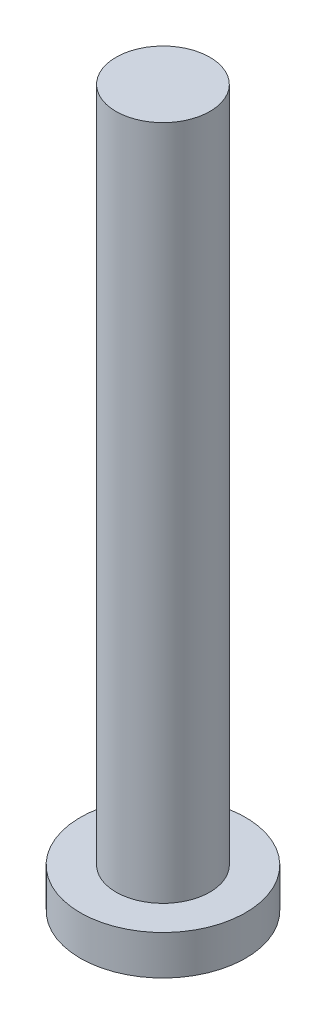
from build123d import *

# Parameters (mm, degrees)
SKETCH1_R           = 4.4
SKETCH1_R_2         = 2.5
BOSS_EXTRUDE1_DEPTH = 2.1
CUT_EXTRUDE1_DEPTH  = 1.27
SKETCH3_R           = 2.5
BOSS_EXTRUDE2_DEPTH = 36


with BuildPart() as part:
    # Sketch1 → Boss-Extrude1 (new body)
    # profile 1 of 2: a face of its own
    with BuildSketch(Plane(origin=(0, 0, 0), x_dir=(1, 0, 0), z_dir=(0, 1, 0))):
        with Locations(Location((0, 0, 0), (0, 0, 270))):
            Circle(SKETCH1_R)
        Circle(SKETCH1_R_2, mode=Mode.SUBTRACT)
    # profile 2 of 2: a face of its own
    with BuildSketch(Plane(origin=(0, 0, 0), x_dir=(1, 0, 0), z_dir=(0, 1, 0))):
        Circle(SKETCH1_R_2)
    extrude(amount=BOSS_EXTRUDE1_DEPTH)

    # Sketch2 → Cut-Extrude1 (cut)
    with BuildSketch(Plane.XZ):
        Polygon((2.886751346, 0), (1.443375673, 2.5), (-1.443375673, 2.5), (-2.886751346, 0), (-1.443375673, -2.5), (1.443375673, -2.5), align=None)
    extrude(amount=-CUT_EXTRUDE1_DEPTH, mode=Mode.SUBTRACT)

    # Sketch3 → Boss-Extrude2 (add)
    with BuildSketch(Plane(origin=(0, 2.1, 0), x_dir=(1, 0, 0), z_dir=(0, 1, 0))):
        with Locations(Location((0, 0, 0), (0, 0, 270))):
            Circle(SKETCH3_R)
    extrude(amount=BOSS_EXTRUDE2_DEPTH)


solid = part.part
